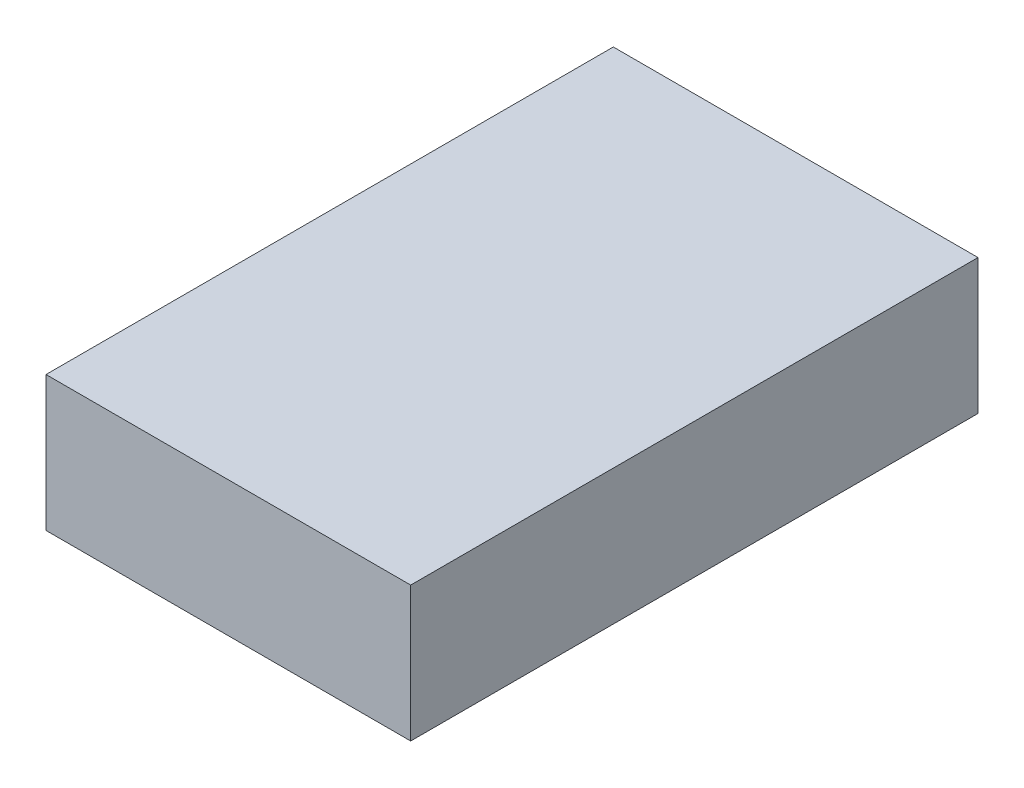
from build123d import *

# Parameters (mm, degrees)
SKETCH1_W           = 135
SKETCH1_H           = 50
BOSS_EXTRUDE1_DEPTH = 210


with BuildPart() as part:
    # Sketch1 → Boss-Extrude1 (new body)
    with BuildSketch(Plane.XY):
        Rectangle(SKETCH1_W, SKETCH1_H)
    extrude(amount=BOSS_EXTRUDE1_DEPTH)


solid = part.part
